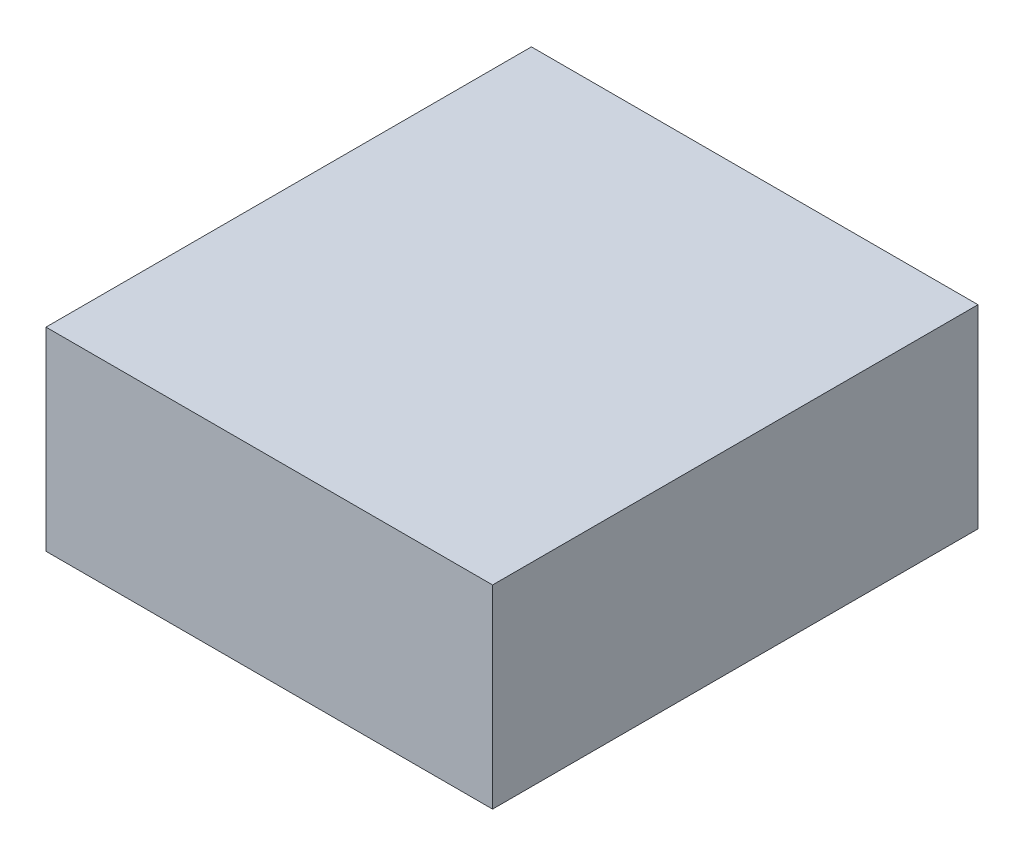
from build123d import *

# Parameters (mm, degrees)
SKETCH1_W           = 46
SKETCH1_H           = 50
BOSS_EXTRUDE1_DEPTH = 20


with BuildPart() as part:
    # Sketch1 → Boss-Extrude1 (new body)
    with BuildSketch(Plane(origin=(0, 0, 0), x_dir=(1, 0, 0), z_dir=(0, 1, 0))):
        with Locations((23, 25)):
            Rectangle(SKETCH1_W, SKETCH1_H)
    extrude(amount=BOSS_EXTRUDE1_DEPTH)


solid = part.part
